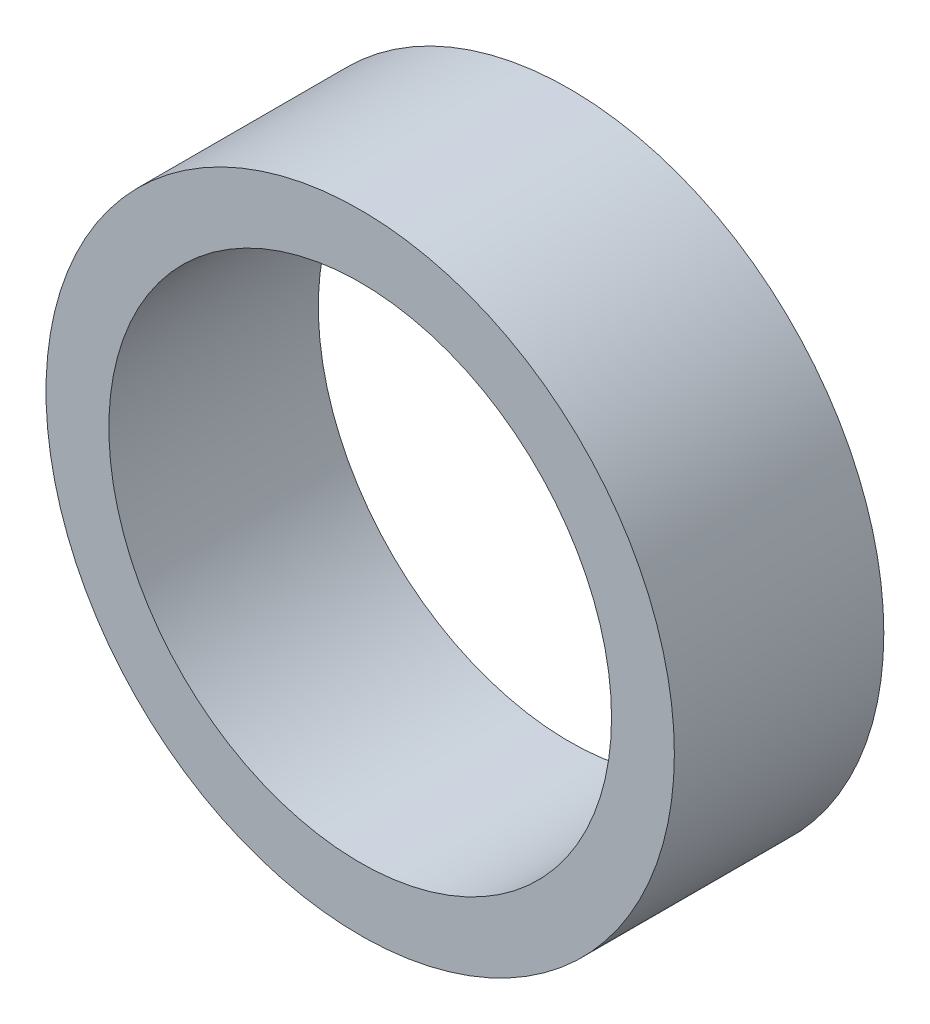
from build123d import *

# Parameters (mm, degrees)
SKETCH_1_R      = 7.5
SKETCH_1_R_2    = 6
EXTRUDE_1_DEPTH = 5


with BuildPart() as part:
    # 스케치1 → 보스-돌출1 (new body)
    with BuildSketch(Plane.XY):
        Circle(SKETCH_1_R)
        Circle(SKETCH_1_R_2, mode=Mode.SUBTRACT)
    extrude(amount=EXTRUDE_1_DEPTH)


solid = part.part
